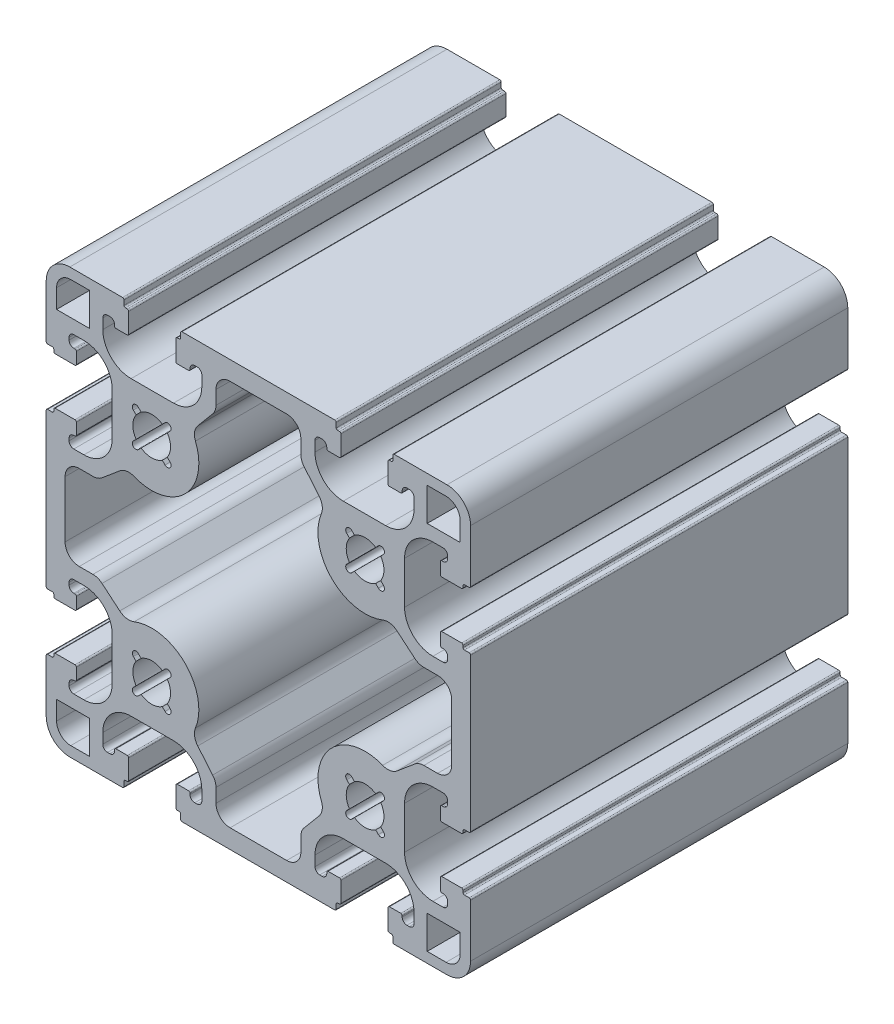
from build123d import *

# Parameters (mm, degrees)
Y_KSEKLIK_EKSTR_ZYON1_DEPTH = 80


with BuildPart() as part:
    # Çizim1 → Yükseklik-Ekstrüzyon1 (new body)
    with BuildSketch(Plane.XY):
        with BuildLine():
            ThreePointArc((45, 16.2), (44.912132034, 16.412132034), (44.7, 16.5))
            Line((44.7, 16.5), (43.7, 16.5))
            ThreePointArc((43.7, 16.5), (43.487867966, 16.587867966), (43.4, 16.8))
            Line((43.4, 16.8), (43.4, 17.2))
            ThreePointArc((43.4, 17.2), (43.312132034, 17.412132034), (43.1, 17.5))
            Line((43.1, 17.5), (38.9, 17.5))
            ThreePointArc((38.9, 17.5), (38.687867966, 17.412132034), (38.6, 17.2))
            Line((38.6, 17.2), (38.6, 14.8))
            ThreePointArc((38.6, 14.8), (38.687867966, 14.587867966), (38.9, 14.5))
            Line((38.9, 14.5), (39.15, 14.5))
            ThreePointArc((39.15, 14.5), (39.857106781, 14.207106781), (40.15, 13.5))
            Line((40.15, 13.5), (40.15, 13))
            ThreePointArc((40.15, 13), (39.857106781, 12.292893219), (39.15, 12))
            Line((39.15, 12), (37, 12))
            ThreePointArc((37, 12), (32.757359313, 13.757359313), (31, 18))
            Line((31, 18), (31, 27))
            ThreePointArc((31, 27), (32.757359313, 31.242640687), (37, 33))
            Line((37, 33), (39.15, 33))
            ThreePointArc((39.15, 33), (39.857106781, 32.707106781), (40.15, 32))
            Line((40.15, 32), (40.15, 31.5))
            ThreePointArc((40.15, 31.5), (39.857106781, 30.792893219), (39.15, 30.5))
            Line((39.15, 30.5), (38.9, 30.5))
            ThreePointArc((38.9, 30.5), (38.687867966, 30.412132034), (38.6, 30.2))
            Line((38.6, 30.2), (38.6, 27.8))
            ThreePointArc((38.6, 27.8), (38.687867966, 27.587867966), (38.9, 27.5))
            Line((38.9, 27.5), (43.1, 27.5))
            ThreePointArc((43.1, 27.5), (43.312132034, 27.587867966), (43.4, 27.8))
            Line((43.4, 27.8), (43.4, 28.2))
            ThreePointArc((43.4, 28.2), (43.487867966, 28.412132034), (43.7, 28.5))
            Line((43.7, 28.5), (44.7, 28.5))
            ThreePointArc((44.7, 28.5), (44.912132034, 28.587867966), (45, 28.8))
            Line((45, 28.8), (45, 40))
            ThreePointArc((45, 40), (43.535533906, 43.535533906), (40, 45))
            Line((40, 45), (28.8, 45))
            ThreePointArc((28.8, 45), (28.587867966, 44.912132034), (28.5, 44.7))
            Line((28.5, 44.7), (28.5, 43.7))
            ThreePointArc((28.5, 43.7), (28.412132034, 43.487867966), (28.2, 43.4))
            Line((28.2, 43.4), (27.8, 43.4))
            ThreePointArc((27.8, 43.4), (27.587867966, 43.312132034), (27.5, 43.1))
            Line((27.5, 43.1), (27.5, 38.9))
            ThreePointArc((27.5, 38.9), (27.587867966, 38.687867966), (27.8, 38.6))
            Line((27.8, 38.6), (30.2, 38.6))
            ThreePointArc((30.2, 38.6), (30.412132034, 38.687867966), (30.5, 38.9))
            Line((30.5, 38.9), (30.5, 39.15))
            ThreePointArc((30.5, 39.15), (30.792893219, 39.857106781), (31.5, 40.15))
            Line((31.5, 40.15), (32, 40.15))
            ThreePointArc((32, 40.15), (32.707106781, 39.857106781), (33, 39.15))
            Line((33, 39.15), (33, 37))
            ThreePointArc((33, 37), (31.242640687, 32.757359313), (27, 31))
            Line((27, 31), (18, 31))
            ThreePointArc((18, 31), (13.757359313, 32.757359313), (12, 37))
            Line((12, 37), (12, 39.15))
            ThreePointArc((12, 39.15), (12.292893219, 39.857106781), (13, 40.15))
            Line((13, 40.15), (13.5, 40.15))
            ThreePointArc((13.5, 40.15), (14.207106781, 39.857106781), (14.5, 39.15))
            Line((14.5, 39.15), (14.5, 38.9))
            ThreePointArc((14.5, 38.9), (14.587867966, 38.687867966), (14.8, 38.6))
            Line((14.8, 38.6), (17.2, 38.6))
            ThreePointArc((17.2, 38.6), (17.412132034, 38.687867966), (17.5, 38.9))
            Line((17.5, 38.9), (17.5, 43.1))
            ThreePointArc((17.5, 43.1), (17.412132034, 43.312132034), (17.2, 43.4))
            Line((17.2, 43.4), (16.8, 43.4))
            ThreePointArc((16.8, 43.4), (16.587867966, 43.487867966), (16.5, 43.7))
            Line((16.5, 43.7), (16.5, 44.7))
            ThreePointArc((16.5, 44.7), (16.412132034, 44.912132034), (16.2, 45))
            Line((16.2, 45), (-16.2, 45))
            ThreePointArc((-16.2, 45), (-16.412132034, 44.912132034), (-16.5, 44.7))
            Line((-16.5, 44.7), (-16.5, 43.7))
            ThreePointArc((-16.5, 43.7), (-16.587867966, 43.487867966), (-16.8, 43.4))
            Line((-16.8, 43.4), (-17.2, 43.4))
            ThreePointArc((-17.2, 43.4), (-17.412132034, 43.312132034), (-17.5, 43.1))
            Line((-17.5, 43.1), (-17.5, 38.9))
            ThreePointArc((-17.5, 38.9), (-17.412132034, 38.687867966), (-17.2, 38.6))
            Line((-17.2, 38.6), (-14.8, 38.6))
            ThreePointArc((-14.8, 38.6), (-14.587867966, 38.687867966), (-14.5, 38.9))
            Line((-14.5, 38.9), (-14.5, 39.15))
            ThreePointArc((-14.5, 39.15), (-14.207106781, 39.857106781), (-13.5, 40.15))
            Line((-13.5, 40.15), (-13, 40.15))
            ThreePointArc((-13, 40.15), (-12.292893219, 39.857106781), (-12, 39.15))
            Line((-12, 39.15), (-12, 37))
            ThreePointArc((-12, 37), (-13.757359313, 32.757359313), (-18, 31))
            Line((-18, 31), (-27, 31))
            ThreePointArc((-27, 31), (-31.242640687, 32.757359313), (-33, 37))
            Line((-33, 37), (-33, 39.15))
            ThreePointArc((-33, 39.15), (-32.707106781, 39.857106781), (-32, 40.15))
            Line((-32, 40.15), (-31.5, 40.15))
            ThreePointArc((-31.5, 40.15), (-30.792893219, 39.857106781), (-30.5, 39.15))
            Line((-30.5, 39.15), (-30.5, 38.9))
            ThreePointArc((-30.5, 38.9), (-30.412132034, 38.687867966), (-30.2, 38.6))
            Line((-30.2, 38.6), (-27.8, 38.6))
            ThreePointArc((-27.8, 38.6), (-27.587867966, 38.687867966), (-27.5, 38.9))
            Line((-27.5, 38.9), (-27.5, 43.1))
            ThreePointArc((-27.5, 43.1), (-27.587867966, 43.312132034), (-27.8, 43.4))
            Line((-27.8, 43.4), (-28.2, 43.4))
            ThreePointArc((-28.2, 43.4), (-28.412132034, 43.487867966), (-28.5, 43.7))
            Line((-28.5, 43.7), (-28.5, 44.7))
            ThreePointArc((-28.5, 44.7), (-28.587867966, 44.912132034), (-28.8, 45))
            Line((-28.8, 45), (-40, 45))
            ThreePointArc((-40, 45), (-43.535533906, 43.535533906), (-45, 40))
            Line((-45, 40), (-45, 28.8))
            ThreePointArc((-45, 28.8), (-44.912132034, 28.587867966), (-44.7, 28.5))
            Line((-44.7, 28.5), (-43.7, 28.5))
            ThreePointArc((-43.7, 28.5), (-43.487867966, 28.412132034), (-43.4, 28.2))
            Line((-43.4, 28.2), (-43.4, 27.8))
            ThreePointArc((-43.4, 27.8), (-43.312132034, 27.587867966), (-43.1, 27.5))
            Line((-43.1, 27.5), (-38.9, 27.5))
            ThreePointArc((-38.9, 27.5), (-38.687867966, 27.587867966), (-38.6, 27.8))
            Line((-38.6, 27.8), (-38.6, 30.2))
            ThreePointArc((-38.6, 30.2), (-38.687867966, 30.412132034), (-38.9, 30.5))
            Line((-38.9, 30.5), (-39.15, 30.5))
            ThreePointArc((-39.15, 30.5), (-39.857106781, 30.792893219), (-40.15, 31.5))
            Line((-40.15, 31.5), (-40.15, 32))
            ThreePointArc((-40.15, 32), (-39.857106781, 32.707106781), (-39.15, 33))
            Line((-39.15, 33), (-37, 33))
            ThreePointArc((-37, 33), (-32.757359313, 31.242640687), (-31, 27))
            Line((-31, 27), (-31, 18))
            ThreePointArc((-31, 18), (-32.757359313, 13.757359313), (-37, 12))
            Line((-37, 12), (-39.15, 12))
            ThreePointArc((-39.15, 12), (-39.857106781, 12.292893219), (-40.15, 13))
            Line((-40.15, 13), (-40.15, 13.5))
            ThreePointArc((-40.15, 13.5), (-39.857106781, 14.207106781), (-39.15, 14.5))
            Line((-39.15, 14.5), (-38.9, 14.5))
            ThreePointArc((-38.9, 14.5), (-38.687867966, 14.587867966), (-38.6, 14.8))
            Line((-38.6, 14.8), (-38.6, 17.2))
            ThreePointArc((-38.6, 17.2), (-38.687867966, 17.412132034), (-38.9, 17.5))
            Line((-38.9, 17.5), (-43.1, 17.5))
            ThreePointArc((-43.1, 17.5), (-43.312132034, 17.412132034), (-43.4, 17.2))
            Line((-43.4, 17.2), (-43.4, 16.8))
            ThreePointArc((-43.4, 16.8), (-43.487867966, 16.587867966), (-43.7, 16.5))
            Line((-43.7, 16.5), (-44.7, 16.5))
            ThreePointArc((-44.7, 16.5), (-44.912132034, 16.412132034), (-45, 16.2))
            Line((-45, 16.2), (-45, -16.2))
            ThreePointArc((-45, -16.2), (-44.912132034, -16.412132034), (-44.7, -16.5))
            Line((-44.7, -16.5), (-43.7, -16.5))
            ThreePointArc((-43.7, -16.5), (-43.487867966, -16.587867966), (-43.4, -16.8))
            Line((-43.4, -16.8), (-43.4, -17.2))
            ThreePointArc((-43.4, -17.2), (-43.312132034, -17.412132034), (-43.1, -17.5))
            Line((-43.1, -17.5), (-38.9, -17.5))
            ThreePointArc((-38.9, -17.5), (-38.687867966, -17.412132034), (-38.6, -17.2))
            Line((-38.6, -17.2), (-38.6, -14.8))
            ThreePointArc((-38.6, -14.8), (-38.687867966, -14.587867966), (-38.9, -14.5))
            Line((-38.9, -14.5), (-39.15, -14.5))
            ThreePointArc((-39.15, -14.5), (-39.857106781, -14.207106781), (-40.15, -13.5))
            Line((-40.15, -13.5), (-40.15, -13))
            ThreePointArc((-40.15, -13), (-39.857106781, -12.292893219), (-39.15, -12))
            Line((-39.15, -12), (-37, -12))
            ThreePointArc((-37, -12), (-32.757359313, -13.757359313), (-31, -18))
            Line((-31, -18), (-31, -27))
            ThreePointArc((-31, -27), (-32.757359313, -31.242640687), (-37, -33))
            Line((-37, -33), (-39.15, -33))
            ThreePointArc((-39.15, -33), (-39.857106781, -32.707106781), (-40.15, -32))
            Line((-40.15, -32), (-40.15, -31.5))
            ThreePointArc((-40.15, -31.5), (-39.857106781, -30.792893219), (-39.15, -30.5))
            Line((-39.15, -30.5), (-38.9, -30.5))
            ThreePointArc((-38.9, -30.5), (-38.687867966, -30.412132034), (-38.6, -30.2))
            Line((-38.6, -30.2), (-38.6, -27.8))
            ThreePointArc((-38.6, -27.8), (-38.687867966, -27.587867966), (-38.9, -27.5))
            Line((-38.9, -27.5), (-43.1, -27.5))
            ThreePointArc((-43.1, -27.5), (-43.312132034, -27.587867966), (-43.4, -27.8))
            Line((-43.4, -27.8), (-43.4, -28.2))
            ThreePointArc((-43.4, -28.2), (-43.487867966, -28.412132034), (-43.7, -28.5))
            Line((-43.7, -28.5), (-44.7, -28.5))
            ThreePointArc((-44.7, -28.5), (-44.912132034, -28.587867966), (-45, -28.8))
            Line((-45, -28.8), (-45, -40))
            ThreePointArc((-45, -40), (-43.535533906, -43.535533906), (-40, -45))
            Line((-40, -45), (-28.8, -45))
            ThreePointArc((-28.8, -45), (-28.587867966, -44.912132034), (-28.5, -44.7))
            Line((-28.5, -44.7), (-28.5, -43.7))
            ThreePointArc((-28.5, -43.7), (-28.412132034, -43.487867966), (-28.2, -43.4))
            Line((-28.2, -43.4), (-27.8, -43.4))
            ThreePointArc((-27.8, -43.4), (-27.587867966, -43.312132034), (-27.5, -43.1))
            Line((-27.5, -43.1), (-27.5, -38.9))
            ThreePointArc((-27.5, -38.9), (-27.587867966, -38.687867966), (-27.8, -38.6))
            Line((-27.8, -38.6), (-30.2, -38.6))
            ThreePointArc((-30.2, -38.6), (-30.412132034, -38.687867966), (-30.5, -38.9))
            Line((-30.5, -38.9), (-30.5, -39.15))
            ThreePointArc((-30.5, -39.15), (-30.792893219, -39.857106781), (-31.5, -40.15))
            Line((-31.5, -40.15), (-32, -40.15))
            ThreePointArc((-32, -40.15), (-32.707106781, -39.857106781), (-33, -39.15))
            Line((-33, -39.15), (-33, -37))
            ThreePointArc((-33, -37), (-31.242640687, -32.757359313), (-27, -31))
            Line((-27, -31), (-18, -31))
            ThreePointArc((-18, -31), (-13.757359313, -32.757359313), (-12, -37))
            Line((-12, -37), (-12, -39.15))
            ThreePointArc((-12, -39.15), (-12.292893219, -39.857106781), (-13, -40.15))
            Line((-13, -40.15), (-13.5, -40.15))
            ThreePointArc((-13.5, -40.15), (-14.207106781, -39.857106781), (-14.5, -39.15))
            Line((-14.5, -39.15), (-14.5, -38.9))
            ThreePointArc((-14.5, -38.9), (-14.587867966, -38.687867966), (-14.8, -38.6))
            Line((-14.8, -38.6), (-17.2, -38.6))
            ThreePointArc((-17.2, -38.6), (-17.412132034, -38.687867966), (-17.5, -38.9))
            Line((-17.5, -38.9), (-17.5, -43.1))
            ThreePointArc((-17.5, -43.1), (-17.412132034, -43.312132034), (-17.2, -43.4))
            Line((-17.2, -43.4), (-16.8, -43.4))
            ThreePointArc((-16.8, -43.4), (-16.587867966, -43.487867966), (-16.5, -43.7))
            Line((-16.5, -43.7), (-16.5, -44.7))
            ThreePointArc((-16.5, -44.7), (-16.412132034, -44.912132034), (-16.2, -45))
            Line((-16.2, -45), (16.2, -45))
            ThreePointArc((16.2, -45), (16.412132034, -44.912132034), (16.5, -44.7))
            Line((16.5, -44.7), (16.5, -43.7))
            ThreePointArc((16.5, -43.7), (16.587867966, -43.487867966), (16.8, -43.4))
            Line((16.8, -43.4), (17.2, -43.4))
            ThreePointArc((17.2, -43.4), (17.412132034, -43.312132034), (17.5, -43.1))
            Line((17.5, -43.1), (17.5, -38.9))
            ThreePointArc((17.5, -38.9), (17.412132034, -38.687867966), (17.2, -38.6))
            Line((17.2, -38.6), (14.8, -38.6))
            ThreePointArc((14.8, -38.6), (14.587867966, -38.687867966), (14.5, -38.9))
            Line((14.5, -38.9), (14.5, -39.15))
            ThreePointArc((14.5, -39.15), (14.207106781, -39.857106781), (13.5, -40.15))
            Line((13.5, -40.15), (13, -40.15))
            ThreePointArc((13, -40.15), (12.292893219, -39.857106781), (12, -39.15))
            Line((12, -39.15), (12, -37))
            ThreePointArc((12, -37), (13.757359313, -32.757359313), (18, -31))
            Line((18, -31), (27, -31))
            ThreePointArc((27, -31), (31.242640687, -32.757359313), (33, -37))
            Line((33, -37), (33, -39.15))
            ThreePointArc((33, -39.15), (32.707106781, -39.857106781), (32, -40.15))
            Line((32, -40.15), (31.5, -40.15))
            ThreePointArc((31.5, -40.15), (30.792893219, -39.857106781), (30.5, -39.15))
            Line((30.5, -39.15), (30.5, -38.9))
            ThreePointArc((30.5, -38.9), (30.412132034, -38.687867966), (30.2, -38.6))
            Line((30.2, -38.6), (27.8, -38.6))
            ThreePointArc((27.8, -38.6), (27.587867966, -38.687867966), (27.5, -38.9))
            Line((27.5, -38.9), (27.5, -43.1))
            ThreePointArc((27.5, -43.1), (27.587867966, -43.312132034), (27.8, -43.4))
            Line((27.8, -43.4), (28.2, -43.4))
            ThreePointArc((28.2, -43.4), (28.412132034, -43.487867966), (28.5, -43.7))
            Line((28.5, -43.7), (28.5, -44.7))
            ThreePointArc((28.5, -44.7), (28.587867966, -44.912132034), (28.8, -45))
            Line((28.8, -45), (40, -45))
            ThreePointArc((40, -45), (43.535533906, -43.535533906), (45, -40))
            Line((45, -40), (45, -28.8))
            ThreePointArc((45, -28.8), (44.912132034, -28.587867966), (44.7, -28.5))
            Line((44.7, -28.5), (43.7, -28.5))
            ThreePointArc((43.7, -28.5), (43.487867966, -28.412132034), (43.4, -28.2))
            Line((43.4, -28.2), (43.4, -27.8))
            ThreePointArc((43.4, -27.8), (43.312132034, -27.587867966), (43.1, -27.5))
            Line((43.1, -27.5), (38.9, -27.5))
            ThreePointArc((38.9, -27.5), (38.687867966, -27.587867966), (38.6, -27.8))
            Line((38.6, -27.8), (38.6, -30.2))
            ThreePointArc((38.6, -30.2), (38.687867966, -30.412132034), (38.9, -30.5))
            Line((38.9, -30.5), (39.15, -30.5))
            ThreePointArc((39.15, -30.5), (39.857106781, -30.792893219), (40.15, -31.5))
            Line((40.15, -31.5), (40.15, -32))
            ThreePointArc((40.15, -32), (39.857106781, -32.707106781), (39.15, -33))
            Line((39.15, -33), (37, -33))
            ThreePointArc((37, -33), (32.757359313, -31.242640687), (31, -27))
            Line((31, -27), (31, -18))
            ThreePointArc((31, -18), (32.757359313, -13.757359313), (37, -12))
            Line((37, -12), (39.15, -12))
            ThreePointArc((39.15, -12), (39.857106781, -12.292893219), (40.15, -13))
            Line((40.15, -13), (40.15, -13.5))
            ThreePointArc((40.15, -13.5), (39.857106781, -14.207106781), (39.15, -14.5))
            Line((39.15, -14.5), (38.9, -14.5))
            ThreePointArc((38.9, -14.5), (38.687867966, -14.587867966), (38.6, -14.8))
            Line((38.6, -14.8), (38.6, -17.2))
            ThreePointArc((38.6, -17.2), (38.687867966, -17.412132034), (38.9, -17.5))
            Line((38.9, -17.5), (43.1, -17.5))
            ThreePointArc((43.1, -17.5), (43.312132034, -17.412132034), (43.4, -17.2))
            Line((43.4, -17.2), (43.4, -16.8))
            ThreePointArc((43.4, -16.8), (43.487867966, -16.587867966), (43.7, -16.5))
            Line((43.7, -16.5), (44.7, -16.5))
            ThreePointArc((44.7, -16.5), (44.912132034, -16.412132034), (45, -16.2))
            Line((45, -16.2), (45, 16.2))
        make_face()
        with BuildLine():
            Line((-6, 41), (6, 41))
            ThreePointArc((6, 41), (8.121320344, 40.121320344), (9, 38))
            Line((9, 38), (9, 35.091910703))
            ThreePointArc((9, 35.091910703), (9.180922138, 34.065850273), (9.701866671, 33.163547874))
            Line((9.701866671, 33.163547874), (12.861186794, 29.398416767))
            ThreePointArc((12.861186794, 29.398416767), (13.525586366, 27.942704768), (13.347137357, 26.352522336))
            ThreePointArc((13.347137357, 26.352522336), (15.556349186, 15.556349186), (26.352522336, 13.347137357))
            ThreePointArc((26.352522336, 13.347137357), (27.942704768, 13.525586366), (29.398416767, 12.861186794))
            Line((29.398416767, 12.861186794), (33.163547874, 9.701866671))
            ThreePointArc((33.163547874, 9.701866671), (34.065850273, 9.180922138), (35.091910703, 9))
            Line((35.091910703, 9), (38, 9))
            ThreePointArc((38, 9), (40.121320344, 8.121320344), (41, 6))
            Line((41, 6), (41, -6))
            ThreePointArc((41, -6), (40.121320344, -8.121320344), (38, -9))
            Line((38, -9), (35.091910703, -9))
            ThreePointArc((35.091910703, -9), (34.065850273, -9.180922138), (33.163547874, -9.701866671))
            Line((33.163547874, -9.701866671), (29.398416767, -12.861186794))
            ThreePointArc((29.398416767, -12.861186794), (27.942704768, -13.525586366), (26.352522336, -13.347137357))
            ThreePointArc((26.352522336, -13.347137357), (15.556349186, -15.556349186), (13.347137357, -26.352522336))
            ThreePointArc((13.347137357, -26.352522336), (13.525586366, -27.942704768), (12.861186794, -29.398416767))
            Line((12.861186794, -29.398416767), (9.701866671, -33.163547874))
            ThreePointArc((9.701866671, -33.163547874), (9.180922138, -34.065850273), (9, -35.091910703))
            Line((9, -35.091910703), (9, -38))
            ThreePointArc((9, -38), (8.121320344, -40.121320344), (6, -41))
            Line((6, -41), (-6, -41))
            ThreePointArc((-6, -41), (-8.121320344, -40.121320344), (-9, -38))
            Line((-9, -38), (-9, -35.091910703))
            ThreePointArc((-9, -35.091910703), (-9.180922138, -34.065850273), (-9.701866671, -33.163547874))
            Line((-9.701866671, -33.163547874), (-12.861186794, -29.398416767))
            ThreePointArc((-12.861186794, -29.398416767), (-13.525586366, -27.942704768), (-13.347137357, -26.352522336))
            ThreePointArc((-13.347137357, -26.352522336), (-15.556349186, -15.556349186), (-26.352522336, -13.347137357))
            ThreePointArc((-26.352522336, -13.347137357), (-27.942704768, -13.525586366), (-29.398416767, -12.861186794))
            Line((-29.398416767, -12.861186794), (-33.163547874, -9.701866671))
            ThreePointArc((-33.163547874, -9.701866671), (-34.065850273, -9.180922138), (-35.091910703, -9))
            Line((-35.091910703, -9), (-38, -9))
            ThreePointArc((-38, -9), (-40.121320344, -8.121320344), (-41, -6))
            Line((-41, -6), (-41, 6))
            ThreePointArc((-41, 6), (-40.121320344, 8.121320344), (-38, 9))
            Line((-38, 9), (-35.091910703, 9))
            ThreePointArc((-35.091910703, 9), (-34.065850273, 9.180922138), (-33.163547874, 9.701866671))
            Line((-33.163547874, 9.701866671), (-29.398416767, 12.861186794))
            ThreePointArc((-29.398416767, 12.861186794), (-27.942704768, 13.525586366), (-26.352522336, 13.347137357))
            ThreePointArc((-26.352522336, 13.347137357), (-15.556349186, 15.556349186), (-13.347137357, 26.352522336))
            ThreePointArc((-13.347137357, 26.352522336), (-13.525586366, 27.942704768), (-12.861186794, 29.398416767))
            Line((-12.861186794, 29.398416767), (-9.701866671, 33.163547874))
            ThreePointArc((-9.701866671, 33.163547874), (-9.180922138, 34.065850273), (-9, 35.091910703))
            Line((-9, 35.091910703), (-9, 38))
            ThreePointArc((-9, 38), (-8.121320344, 40.121320344), (-6, 41))
        make_face(mode=Mode.SUBTRACT)
        with BuildLine():
            Line((-25.93601093, 24.875350758), (-26.516504294, 25.455844123))
            ThreePointArc((-26.516504294, 25.455844123), (-26.516504294, 26.516504294), (-25.455844123, 26.516504294))
            Line((-25.455844123, 26.516504294), (-24.875350758, 25.93601093))
            ThreePointArc((-24.875350758, 25.93601093), (-22.627416998, 26.627416998), (-20.379483237, 25.93601093))
            Line((-20.379483237, 25.93601093), (-19.798989873, 26.516504294))
            ThreePointArc((-19.798989873, 26.516504294), (-18.738329701, 26.516504294), (-18.738329701, 25.455844123))
            Line((-18.738329701, 25.455844123), (-19.318823066, 24.875350758))
            ThreePointArc((-19.318823066, 24.875350758), (-18.627416998, 22.627416998), (-19.318823066, 20.379483237))
            Line((-19.318823066, 20.379483237), (-18.738329701, 19.798989873))
            ThreePointArc((-18.738329701, 19.798989873), (-18.738329701, 18.738329701), (-19.798989873, 18.738329701))
            Line((-19.798989873, 18.738329701), (-20.379483237, 19.318823066))
            ThreePointArc((-20.379483237, 19.318823066), (-22.627416998, 18.627416998), (-24.875350758, 19.318823066))
            Line((-24.875350758, 19.318823066), (-25.455844123, 18.738329701))
            ThreePointArc((-25.455844123, 18.738329701), (-26.516504294, 18.738329701), (-26.516504294, 19.798989873))
            Line((-26.516504294, 19.798989873), (-25.93601093, 20.379483237))
            ThreePointArc((-25.93601093, 20.379483237), (-26.627416998, 22.627416998), (-25.93601093, 24.875350758))
        make_face(mode=Mode.SUBTRACT)
        with BuildLine():
            Line((-35.8, 42.8), (-35.8, 35.8))
            Line((-35.8, 35.8), (-42.8, 35.8))
            Line((-42.8, 35.8), (-42.8, 39.8))
            ThreePointArc((-42.8, 39.8), (-41.921320344, 41.921320344), (-39.8, 42.8))
            Line((-39.8, 42.8), (-35.8, 42.8))
        make_face(mode=Mode.SUBTRACT)
        with BuildLine():
            Line((35.8, 42.8), (39.8, 42.8))
            ThreePointArc((39.8, 42.8), (41.921320344, 41.921320344), (42.8, 39.8))
            Line((42.8, 39.8), (42.8, 35.8))
            Line((42.8, 35.8), (35.8, 35.8))
            Line((35.8, 35.8), (35.8, 42.8))
        make_face(mode=Mode.SUBTRACT)
        with BuildLine():
            Line((24.875350758, 25.93601093), (25.455844123, 26.516504294))
            ThreePointArc((25.455844123, 26.516504294), (26.516504294, 26.516504294), (26.516504294, 25.455844123))
            Line((26.516504294, 25.455844123), (25.93601093, 24.875350758))
            ThreePointArc((25.93601093, 24.875350758), (26.627416998, 22.627416998), (25.93601093, 20.379483237))
            Line((25.93601093, 20.379483237), (26.516504294, 19.798989873))
            ThreePointArc((26.516504294, 19.798989873), (26.516504294, 18.738329701), (25.455844123, 18.738329701))
            Line((25.455844123, 18.738329701), (24.875350758, 19.318823066))
            ThreePointArc((24.875350758, 19.318823066), (22.627416998, 18.627416998), (20.379483237, 19.318823066))
            Line((20.379483237, 19.318823066), (19.798989873, 18.738329701))
            ThreePointArc((19.798989873, 18.738329701), (18.738329701, 18.738329701), (18.738329701, 19.798989873))
            Line((18.738329701, 19.798989873), (19.318823066, 20.379483237))
            ThreePointArc((19.318823066, 20.379483237), (18.627416998, 22.627416998), (19.318823066, 24.875350758))
            Line((19.318823066, 24.875350758), (18.738329701, 25.455844123))
            ThreePointArc((18.738329701, 25.455844123), (18.738329701, 26.516504294), (19.798989873, 26.516504294))
            Line((19.798989873, 26.516504294), (20.379483237, 25.93601093))
            ThreePointArc((20.379483237, 25.93601093), (22.627416998, 26.627416998), (24.875350758, 25.93601093))
        make_face(mode=Mode.SUBTRACT)
        with BuildLine():
            ThreePointArc((-25.455844123, -26.516504294), (-26.516504294, -26.516504294), (-26.516504294, -25.455844123))
            Line((-26.516504294, -25.455844123), (-25.93601093, -24.875350758))
            ThreePointArc((-25.93601093, -24.875350758), (-26.627416998, -22.627416998), (-25.93601093, -20.379483237))
            Line((-25.93601093, -20.379483237), (-26.516504294, -19.798989873))
            ThreePointArc((-26.516504294, -19.798989873), (-26.516504294, -18.738329701), (-25.455844123, -18.738329701))
            Line((-25.455844123, -18.738329701), (-24.875350758, -19.318823066))
            ThreePointArc((-24.875350758, -19.318823066), (-22.627416998, -18.627416998), (-20.379483237, -19.318823066))
            Line((-20.379483237, -19.318823066), (-19.798989873, -18.738329701))
            ThreePointArc((-19.798989873, -18.738329701), (-18.738329701, -18.738329701), (-18.738329701, -19.798989873))
            Line((-18.738329701, -19.798989873), (-19.318823066, -20.379483237))
            ThreePointArc((-19.318823066, -20.379483237), (-18.627416998, -22.627416998), (-19.318823066, -24.875350758))
            Line((-19.318823066, -24.875350758), (-18.738329701, -25.455844123))
            ThreePointArc((-18.738329701, -25.455844123), (-18.738329701, -26.516504294), (-19.798989873, -26.516504294))
            Line((-19.798989873, -26.516504294), (-20.379483237, -25.93601093))
            ThreePointArc((-20.379483237, -25.93601093), (-22.627416998, -26.627416998), (-24.875350758, -25.93601093))
            Line((-24.875350758, -25.93601093), (-25.455844123, -26.516504294))
        make_face(mode=Mode.SUBTRACT)
        with BuildLine():
            Line((-35.8, -35.8), (-35.8, -42.8))
            Line((-35.8, -42.8), (-39.8, -42.8))
            ThreePointArc((-39.8, -42.8), (-41.921320344, -41.921320344), (-42.8, -39.8))
            Line((-42.8, -39.8), (-42.8, -35.8))
            Line((-42.8, -35.8), (-35.8, -35.8))
        make_face(mode=Mode.SUBTRACT)
        with BuildLine():
            ThreePointArc((26.516504294, -25.455844123), (26.516504294, -26.516504294), (25.455844123, -26.516504294))
            Line((25.455844123, -26.516504294), (24.875350758, -25.93601093))
            ThreePointArc((24.875350758, -25.93601093), (22.627416998, -26.627416998), (20.379483237, -25.93601093))
            Line((20.379483237, -25.93601093), (19.798989873, -26.516504294))
            ThreePointArc((19.798989873, -26.516504294), (18.738329701, -26.516504294), (18.738329701, -25.455844123))
            Line((18.738329701, -25.455844123), (19.318823066, -24.875350758))
            ThreePointArc((19.318823066, -24.875350758), (18.627416998, -22.627416998), (19.318823066, -20.379483237))
            Line((19.318823066, -20.379483237), (18.738329701, -19.798989873))
            ThreePointArc((18.738329701, -19.798989873), (18.738329701, -18.738329701), (19.798989873, -18.738329701))
            Line((19.798989873, -18.738329701), (20.379483237, -19.318823066))
            ThreePointArc((20.379483237, -19.318823066), (22.627416998, -18.627416998), (24.875350758, -19.318823066))
            Line((24.875350758, -19.318823066), (25.455844123, -18.738329701))
            ThreePointArc((25.455844123, -18.738329701), (26.516504294, -18.738329701), (26.516504294, -19.798989873))
            Line((26.516504294, -19.798989873), (25.93601093, -20.379483237))
            ThreePointArc((25.93601093, -20.379483237), (26.627416998, -22.627416998), (25.93601093, -24.875350758))
            Line((25.93601093, -24.875350758), (26.516504294, -25.455844123))
        make_face(mode=Mode.SUBTRACT)
        with BuildLine():
            Line((35.8, -35.8), (42.8, -35.8))
            Line((42.8, -35.8), (42.8, -39.8))
            ThreePointArc((42.8, -39.8), (41.921320344, -41.921320344), (39.8, -42.8))
            Line((39.8, -42.8), (35.8, -42.8))
            Line((35.8, -42.8), (35.8, -35.8))
        make_face(mode=Mode.SUBTRACT)
    extrude(amount=-Y_KSEKLIK_EKSTR_ZYON1_DEPTH)


solid = part.part
